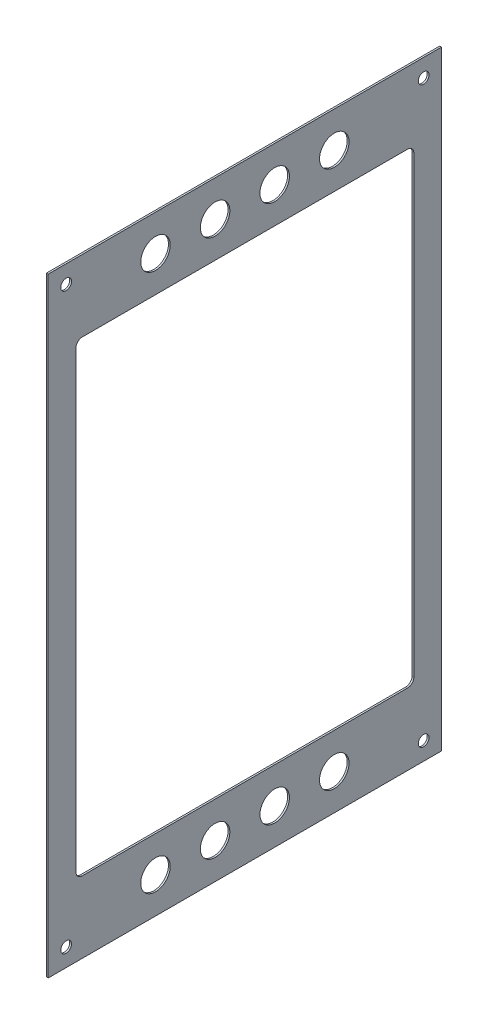
from build123d import *

# Parameters (mm, degrees)
SKETCH1_W           = 341
SKETCH1_H           = 220
BOSS_EXTRUDE1_DEPTH = 1
SKETCH2_R           = 8.25
CUT_EXTRUDE1_DEPTH  = 203.906998401
SKETCH3_R           = 3
CUT_EXTRUDE2_DEPTH  = 203.906998401


with BuildPart() as part:
    # Sketch1 → Boss-Extrude1 (new body)
    with BuildSketch(Plane.YZ):
        Rectangle(SKETCH1_W, SKETCH1_H)
    extrude(amount=BOSS_EXTRUDE1_DEPTH)

    # Sketch2 → Cut-Extrude1 (cut, through all)
    with BuildSketch(Plane.YZ.offset(1)):
        with Locations(Location((150.50261802, 50, 0), (0, 0, 270))):
            Circle(SKETCH2_R)
        with Locations(Location((150.50261802, 16.67, 0), (0, 0, 270))):
            Circle(SKETCH2_R)
        with Locations(Location((150.50261802, -16.67, 0), (0, 0, 90))):
            Circle(SKETCH2_R)
        with Locations(Location((150.50261802, -50, 0), (0, 0, 90))):
            Circle(SKETCH2_R)
        with Locations(Location((-150.50261802, -50, 0), (0, 0, 270))):
            Circle(SKETCH2_R)
        with Locations(Location((-150.50261802, -16.67, 0), (0, 0, 270))):
            Circle(SKETCH2_R)
        with Locations(Location((-150.50261802, 16.67, 0), (0, 0, 90))):
            Circle(SKETCH2_R)
        with Locations(Location((-150.50261802, 50, 0), (0, 0, 90))):
            Circle(SKETCH2_R)
        with BuildLine():
            Line((-130.50261802, 91.002659242), (-130.502618018, -91.002659141))
            ThreePointArc((-130.502618018, -91.002659141), (-129.477508731, -93.477508839), (-127.002658987, -94.502618015))
            Line((-127.002658987, -94.502618015), (127.002659141, -94.502618018))
            ThreePointArc((127.002659141, -94.502618018), (129.477508787, -93.477508786), (130.50261802, -91.002659141))
            Line((130.50261802, -91.002659141), (130.502618017, 91.002659141))
            ThreePointArc((130.502618017, 91.002659141), (129.477508731, 93.477508839), (127.002658987, 94.502618015))
            Line((127.002658987, 94.502618015), (-127.00265914, 94.502618018))
            ThreePointArc((-127.00265914, 94.502618018), (-129.477508751, 93.477508822), (-130.50261802, 91.002659242))
        make_face()
    extrude(amount=-CUT_EXTRUDE1_DEPTH, mode=Mode.SUBTRACT)

    # Sketch3 → Cut-Extrude2 (cut, through all)
    with BuildSketch(Plane.YZ.offset(1)):
        with Locations(Location((-160.5, 100, 0), (0, 0, 270))):
            Circle(SKETCH3_R)
        with Locations(Location((160.5, 100, 0), (0, 0, 90))):
            Circle(SKETCH3_R)
        with Locations(Location((-160.5, -100, 0), (0, 0, 90))):
            Circle(SKETCH3_R)
        with Locations(Location((160.5, -100, 0), (0, 0, 270))):
            Circle(SKETCH3_R)
    extrude(amount=-CUT_EXTRUDE2_DEPTH, mode=Mode.SUBTRACT)


solid = part.part
